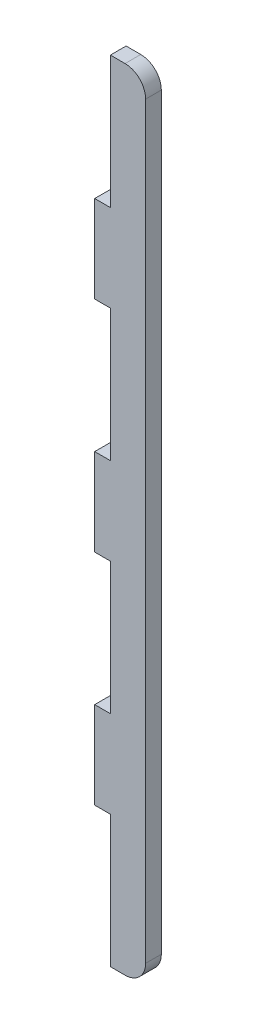
from build123d import *

# Parameters (mm, degrees)
BOSS_EXTRUDE1_DEPTH = 5.35


with BuildPart() as part:
    # Model → Boss-Extrude1 (new body)
    with BuildSketch(Plane.XY):
        with BuildLine():
            Line((10.350000329, 268.999993801), (5.350000225, 268.999993801))
            Line((5.350000225, 268.999993801), (5.350000225, 223.999992013))
            Line((5.350000225, 223.999992013), (0, 223.999992013))
            Line((0, 223.999992013), (0, 194.333329797))
            Line((0, 194.333329797), (5.350000225, 194.333329797))
            Line((5.350000225, 194.333329797), (5.350000225, 149.333328009))
            Line((5.350000225, 149.333328009), (0, 149.333328009))
            Line((0, 149.333328009), (0, 119.666665792))
            Line((0, 119.666665792), (5.350000225, 119.666665792))
            Line((5.350000225, 119.666665792), (5.350000225, 74.666664004))
            Line((5.350000225, 74.666664004), (0, 74.666664004))
            Line((0, 74.666664004), (0, 44.999986887))
            Line((0, 44.999986887), (5.350000225, 44.999986887))
            Line((5.350000225, 44.999986887), (5.350000225, 0))
            Line((5.350000225, 0), (10.350000113, 0))
            ThreePointArc((10.350000113, 0), (15.299747721, 2.050252455), (17.350000329, 7))
            Line((17.350000329, 7), (17.350000329, 261.999993585))
            ThreePointArc((17.350000329, 261.999993585), (15.299747874, 266.949741193), (10.350000329, 268.999993801))
        make_face()
    extrude(amount=BOSS_EXTRUDE1_DEPTH)


solid = part.part
